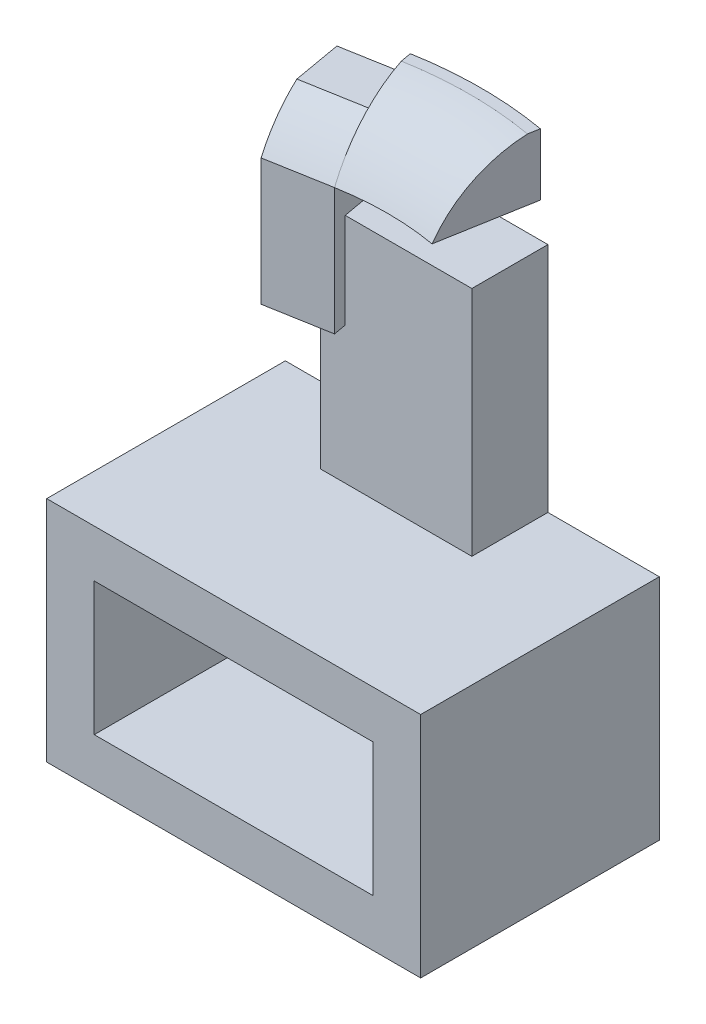
from build123d import *

# Parameters (mm, degrees)
SKETCH3_W           = 59
SKETCH3_H           = 36
SKETCH3_W_2         = 44
SKETCH3_H_2         = 21
BOSS_EXTRUDE1_DEPTH = 10
SKETCH3_2_W         = 59
SKETCH3_2_H         = 36
SKETCH3_2_W_2       = 44
SKETCH3_2_H_2       = 21
BOSS_EXTRUDE2_DEPTH = 5
SKETCH4_W           = 23.855112314
SKETCH4_H           = 12
BOSS_EXTRUDE3_DEPTH = 36.6
REVOLVE1_ANGLE      = 20
BOSS_EXTRUDE4_DEPTH = 10
BOSS_EXTRUDE5_REACH = 83.498
SKETCH9_W           = 12
SKETCH9_H           = 10.265164511
SKETCH3_4_W         = 59
SKETCH3_4_H         = 36
SKETCH3_4_W_2       = 44
SKETCH3_4_H_2       = 21
BOSS_EXTRUDE6_DEPTH = 7.65
BOSS_EXTRUDE7_START = 7.65
SKETCH3_5_W         = 59
SKETCH3_5_H         = 36
SKETCH3_5_W_2       = 44
SKETCH3_5_H_2       = 21
BOSS_EXTRUDE7_DEPTH = 25


with BuildPart() as part:
    # Sketch3 → Boss-Extrude1 (new body)
    with BuildSketch(Plane.XY):
        Rectangle(SKETCH3_W, SKETCH3_H)
        Rectangle(SKETCH3_W_2, SKETCH3_H_2, mode=Mode.SUBTRACT)
    extrude(amount=BOSS_EXTRUDE1_DEPTH)

    # Sketch3<2> → Boss-Extrude2 (add)
    # profile 1 of 2: a face of its own
    with BuildSketch(Plane.XY):
        Rectangle(SKETCH3_2_W, SKETCH3_2_H)
        Rectangle(SKETCH3_2_W_2, SKETCH3_2_H_2, mode=Mode.SUBTRACT)
    # profile 2 of 2: a face of its own
    with BuildSketch(Plane.XY):
        Rectangle(SKETCH3_2_W_2, SKETCH3_2_H_2)
    extrude(amount=-BOSS_EXTRUDE2_DEPTH)

    # Sketch4 → Boss-Extrude3 (add)
    with BuildSketch(Plane(origin=(0, 18, 0), x_dir=(1, 0, 0), z_dir=(0, 1, 0))):
        with Locations((0, -1)):
            Rectangle(SKETCH4_W, SKETCH4_H)
    extrude(amount=BOSS_EXTRUDE3_DEPTH)



with BuildPart() as body_2:
    # Sketch5 → Revolve1 (revolve, symmetric)
    with BuildSketch(Plane(origin=(0, 0, 0), x_dir=(0, 0, -1), z_dir=(1, 0, 0))) as revolve1_sk:
        with BuildLine():
            Line((6.375, 59.6), (-8.375, 59.6))
            ThreePointArc((-8.375, 59.6), (-2.924218778, 65.873958371), (4.625, 69.35))
            Line((4.625, 69.35), (6.375, 69.35))
            Line((6.375, 69.35), (6.375, 59.6))
        make_face()
    revolve(axis=Axis((0, -41.396267669, 52.68), (0, 1, 0)), revolution_arc=REVOLVE1_ANGLE / 2)
    revolve(revolve1_sk.sketch, axis=Axis((0, -41.396267669, 52.68), (0, -1, 0)), revolution_arc=REVOLVE1_ANGLE / 2)

    # Sketch7 → Boss-Extrude4 (add)
    with BuildSketch(Plane(origin=(-9.008810575, 0, 1.588496368), x_dir=(-0.17364817766693075, 0, -0.9848077530122081), z_dir=(0.9848077530122081, 0, -0.17364817766693075))):
        with BuildLine():
            Line((7.175327571, 59.6), (7.175327571, 66.343971629))
            Line((7.175327571, 66.343971629), (-0.614099568, 66.343971629))
            ThreePointArc((-0.614099568, 66.343971629), (-4.541815528, 63.433785776), (-7.574672429, 59.6))
            Line((-7.574672429, 59.6), (-7.574672429, 39.6))
            Line((-7.574672429, 39.6), (7.175327571, 39.6))
            Line((7.175327571, 39.6), (7.175327571, 59.6))
        make_face()
    extrude(amount=-BOSS_EXTRUDE4_DEPTH)


with BuildPart() as part_1:
    add(part.part)

    add(body_2.part)  # Boss-Extrude5 merges body 2
    # Boss-Extrude5: up to this plane
    boss_extrude5_end = Plane(origin=(-9.008810575, 0, 1.588496368), z_dir=(-0.9848077530122081, 0, 0.17364817766693075))
    # Sketch9 → Boss-Extrude5 (add, up to the surface)
    with BuildSketch(Plane(origin=(-11.927556157, 0, 0), x_dir=(0, 0, -1), z_dir=(1, 0, 0)), mode=Mode.PRIVATE) as boss_extrude5_sk1:
        with Locations((-1, 49.467417744)):
            Rectangle(SKETCH9_W, SKETCH9_H)
    boss_extrude5_tool1 = split(extrude(boss_extrude5_sk1.sketch, amount=BOSS_EXTRUDE5_REACH, mode=Mode.PRIVATE), bisect_by=boss_extrude5_end, keep=Keep.BOTH, mode=Mode.PRIVATE)
    add(boss_extrude5_tool1.solids().sort_by_distance((-11.927556, 49.467418, 1))[0])

    # Sketch3<4> → Boss-Extrude6 (add)
    # profile 1 of 2: a face of its own
    with BuildSketch(Plane.XY):
        Rectangle(SKETCH3_4_W, SKETCH3_4_H)
        Rectangle(SKETCH3_4_W_2, SKETCH3_4_H_2, mode=Mode.SUBTRACT)
    # profile 2 of 2: a face of its own
    with BuildSketch(Plane.XY):
        Rectangle(SKETCH3_4_W_2, SKETCH3_4_H_2)
    extrude(amount=BOSS_EXTRUDE6_DEPTH)

    # Sketch3<5> → Boss-Extrude7 (add)
    with BuildSketch(Plane.XY.offset(BOSS_EXTRUDE7_START)):
        Rectangle(SKETCH3_5_W, SKETCH3_5_H)
        Rectangle(SKETCH3_5_W_2, SKETCH3_5_H_2, mode=Mode.SUBTRACT)
    extrude(amount=BOSS_EXTRUDE7_DEPTH)


solid = part_1.part
